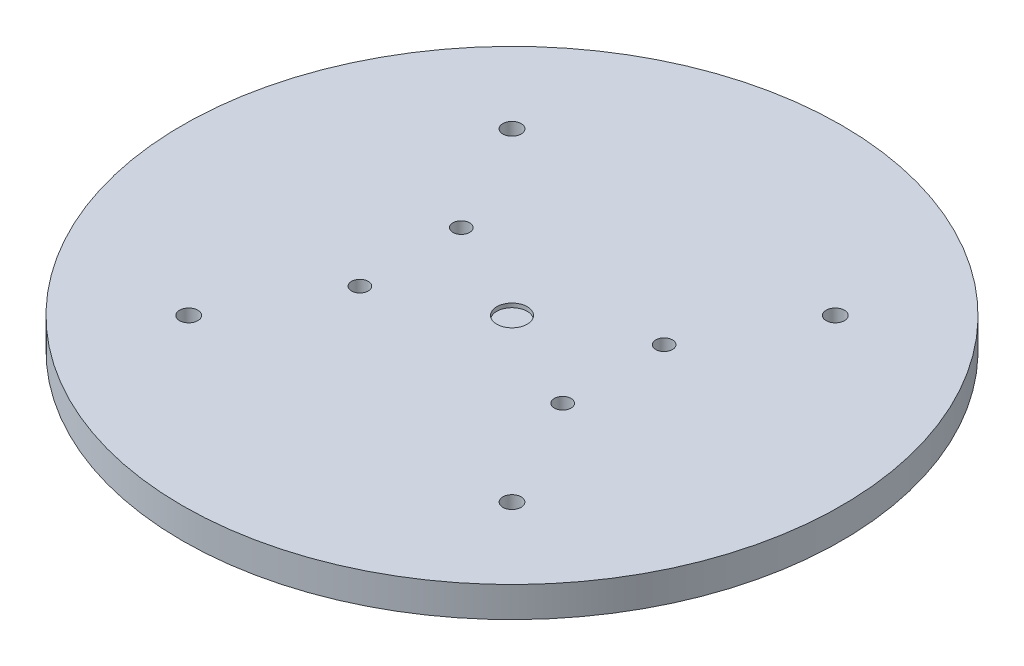
from build123d import *

# Parameters (mm, degrees)
SKETCH1_R           = 82.55
SKETCH1_R_2         = 2.286
BOSS_EXTRUDE2_DEPTH = 7.62
SKETCH2_R           = 3.81
CUT_EXTRUDE1_DEPTH  = 1.016
SKETCH3_R           = 2.1
CUT_EXTRUDE2_DEPTH  = 54.356


with BuildPart() as part:
    # Sketch1 → Boss-Extrude2 (new body)
    with BuildSketch(Plane(origin=(0, 0, 0), x_dir=(1, 0, 0), z_dir=(0, 1, 0))):
        with Locations(Location((0, 0, 0), (0, 0, 90))):
            Circle(SKETCH1_R)
        with Locations(Location((40.49, 40.49, 0), (0, 0, 90))):
            Circle(SKETCH1_R_2, mode=Mode.SUBTRACT)
        with Locations(Location((40.49, -40.49, 0), (0, 0, 90))):
            Circle(SKETCH1_R_2, mode=Mode.SUBTRACT)
        with Locations(Location((-40.49, -40.49, 0), (0, 0, 90))):
            Circle(SKETCH1_R_2, mode=Mode.SUBTRACT)
        with Locations(Location((-40.49, 40.49, 0), (0, 0, 90))):
            Circle(SKETCH1_R_2, mode=Mode.SUBTRACT)
    extrude(amount=BOSS_EXTRUDE2_DEPTH)

    # Sketch2 → Cut-Extrude1 (cut)
    with BuildSketch(Plane(origin=(0, 7.62, 0), x_dir=(1, 0, 0), z_dir=(0, 1, 0))):
        with Locations(Location((0, 0, 0), (0, 0, 270))):
            Circle(SKETCH2_R)
    extrude(amount=-CUT_EXTRUDE1_DEPTH, mode=Mode.SUBTRACT)

    # Sketch3 → Cut-Extrude2 (cut)
    with BuildSketch(Plane.XZ):
        with Locations(Location((-25.4, 12.7, 0), (0, 0, 270))):
            Circle(SKETCH3_R)
        with Locations(Location((25.4, 12.7, 0), (0, 0, 270))):
            Circle(SKETCH3_R)
        with Locations(Location((25.4, -12.7, 0), (0, 0, 270))):
            Circle(SKETCH3_R)
        with Locations(Location((-25.4, -12.7, 0), (0, 0, 270))):
            Circle(SKETCH3_R)
    extrude(amount=-CUT_EXTRUDE2_DEPTH, mode=Mode.SUBTRACT)


solid = part.part
